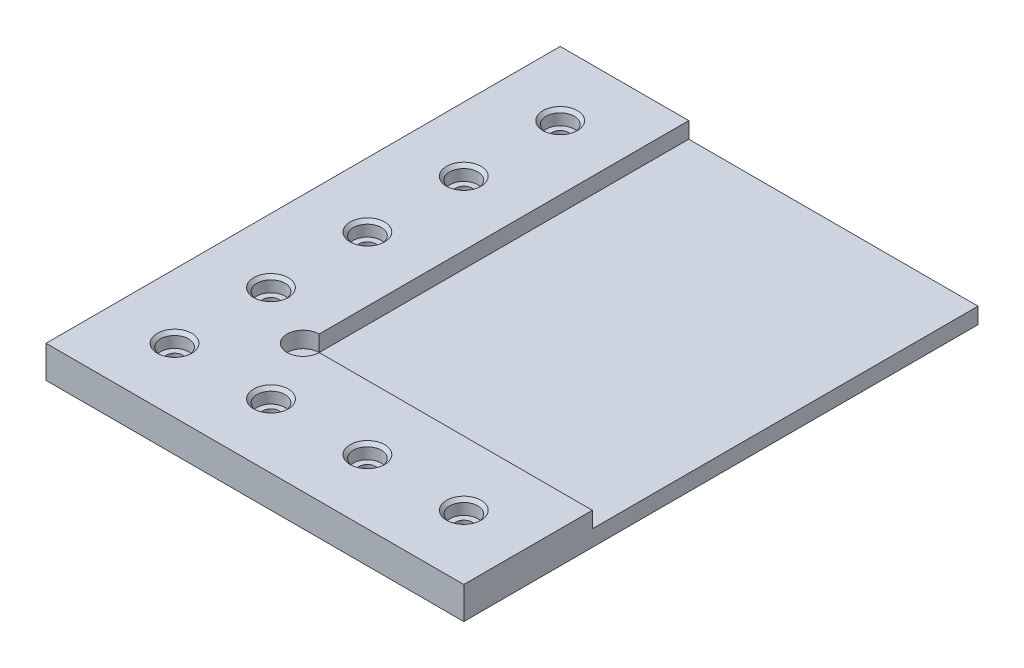
from build123d import *

# Parameters (mm, degrees)
BASE_PLATE_W                    = 82.55
BASE_PLATE_H                    = 101.6
MAIN_BODY_DEPTH                 = 6.35
MOUNTING_HOLES_CBORE_AT_2_COUNT = 2
MOUNTING_HOLES_CBORE_AT_2_PITCH = 19.05
MOUNTING_HOLES_CBORE_AT_3_COUNT = 2
MOUNTING_HOLES_CBORE_AT_3_PITCH = 38.1
MOUNTING_HOLES_CBORE_AT_4_COUNT = 2
MOUNTING_HOLES_CBORE_AT_4_PITCH = 57.15
MOUNTING_HOLES_CBORE_AT_5_COUNT = 2
MOUNTING_HOLES_CBORE_AT_5_PITCH = 19.05
MOUNTING_HOLES_CBORE_AT_6_COUNT = 2
MOUNTING_HOLES_CBORE_AT_6_PITCH = 38.1
MOUNTING_HOLES_CBORE_AT_7_COUNT = 2
MOUNTING_HOLES_CBORE_AT_7_PITCH = 57.15
MOUNTING_HOLES_CBORE_AT_8_COUNT = 2
MOUNTING_HOLES_CBORE_AT_8_PITCH = 76.2
L_AREA_EXCLUSION_W              = 57.15
L_AREA_EXCLUSION_H              = 76.2
L_AREA_STEP_CUT_DEPTH           = 3.175
RELIEF_CIRCLE_SKETCH_R          = 3.175
SUBSTRATE_RELIEF_POCKET_DEPTH   = 3.175


with BuildPart() as part:
    # Base Plate → Main Body (new body)
    with BuildSketch(Plane(origin=(0, 0, 0), x_dir=(1, 0, 0), z_dir=(0, 1, 0))):
        Rectangle(BASE_PLATE_W, BASE_PLATE_H)
    extrude(amount=MAIN_BODY_DEPTH)

    # Hole Profile → Mounting Holes _CBORE (revolve, cut)
    with BuildSketch(Plane(origin=(-28.575, 6.35, 38.1), x_dir=(0, 0, 1), z_dir=(1, 0, 0))):
        Polygon((0, 0), (0, 6.35), (1.63195, 6.35), (1.63195, 2.8448), (2.77876, 2.8448), (2.77876, 0.635), (3.41376, 0), align=None)
    mounting_holes_cbore = revolve(axis=Axis((-28.575, 12.7, 38.1), (0, -1, 0)), mode=Mode.SUBTRACT)

    # Mounting Holes _CBORE at 2: Mounting Holes _CBORE ×2
    with Locations(*[(i * MOUNTING_HOLES_CBORE_AT_2_PITCH, 0, 0) for i in range(1, MOUNTING_HOLES_CBORE_AT_2_COUNT)]):
        add(mounting_holes_cbore, mode=Mode.SUBTRACT)

    # Mounting Holes _CBORE at 3: Mounting Holes _CBORE ×2
    with Locations(*[(i * MOUNTING_HOLES_CBORE_AT_3_PITCH, 0, 0) for i in range(1, MOUNTING_HOLES_CBORE_AT_3_COUNT)]):
        add(mounting_holes_cbore, mode=Mode.SUBTRACT)

    # Mounting Holes _CBORE at 4: Mounting Holes _CBORE ×2
    with Locations(*[(i * MOUNTING_HOLES_CBORE_AT_4_PITCH, 0, 0) for i in range(1, MOUNTING_HOLES_CBORE_AT_4_COUNT)]):
        add(mounting_holes_cbore, mode=Mode.SUBTRACT)

    # Mounting Holes _CBORE at 5: Mounting Holes _CBORE ×2
    with Locations(*[(0, 0, -i * MOUNTING_HOLES_CBORE_AT_5_PITCH) for i in range(1, MOUNTING_HOLES_CBORE_AT_5_COUNT)]):
        add(mounting_holes_cbore, mode=Mode.SUBTRACT)

    # Mounting Holes _CBORE at 6: Mounting Holes _CBORE ×2
    with Locations(*[(0, 0, -i * MOUNTING_HOLES_CBORE_AT_6_PITCH) for i in range(1, MOUNTING_HOLES_CBORE_AT_6_COUNT)]):
        add(mounting_holes_cbore, mode=Mode.SUBTRACT)

    # Mounting Holes _CBORE at 7: Mounting Holes _CBORE ×2
    with Locations(*[(0, 0, -i * MOUNTING_HOLES_CBORE_AT_7_PITCH) for i in range(1, MOUNTING_HOLES_CBORE_AT_7_COUNT)]):
        add(mounting_holes_cbore, mode=Mode.SUBTRACT)

    # Mounting Holes _CBORE at 8: Mounting Holes _CBORE ×2
    with Locations(*[(0, 0, -i * MOUNTING_HOLES_CBORE_AT_8_PITCH) for i in range(1, MOUNTING_HOLES_CBORE_AT_8_COUNT)]):
        add(mounting_holes_cbore, mode=Mode.SUBTRACT)

    # L-Area Exclusion → L-Area Step Cut (cut)
    with BuildSketch(Plane(origin=(0, 6.35, 0), x_dir=(1, 0, 0), z_dir=(0, 1, 0))):
        with Locations((12.7, 12.7)):
            Rectangle(L_AREA_EXCLUSION_W, L_AREA_EXCLUSION_H)
    extrude(amount=-L_AREA_STEP_CUT_DEPTH, mode=Mode.SUBTRACT)

    # Relief Circle Sketch → Substrate Relief Pocket (cut)
    with BuildSketch(Plane(origin=(0, 6.35, 0), x_dir=(1, 0, 0), z_dir=(0, 1, 0))):
        with Locations((-15.875, -25.4)):
            Circle(RELIEF_CIRCLE_SKETCH_R)
    extrude(amount=-SUBSTRATE_RELIEF_POCKET_DEPTH, mode=Mode.SUBTRACT)


solid = part.part
